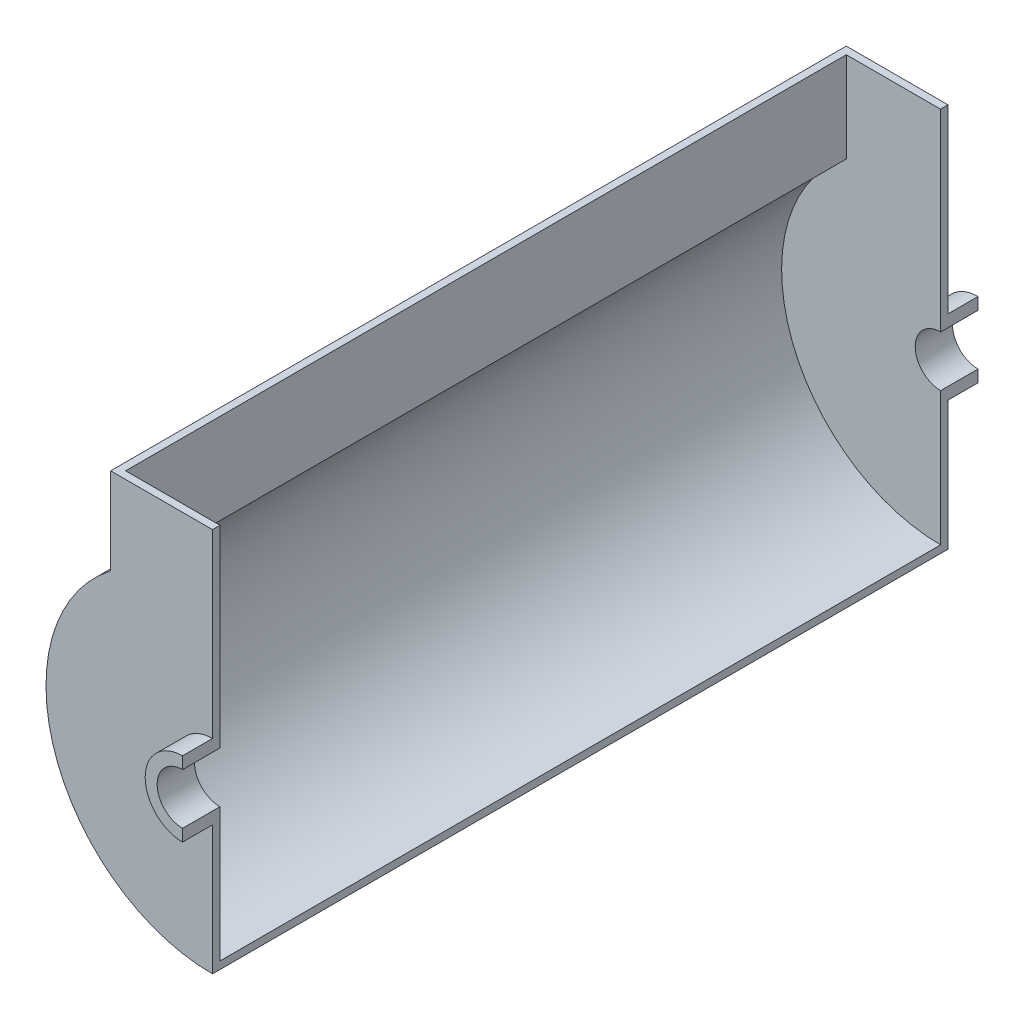
from build123d import *

# Parameters (mm, degrees)
BOSS_EXTRUDE1_DEPTH      = 20
BOSS_EXTRUDE1_DEPTH_BACK = 5
BOSS_EXTRUDE2_START      = -5
BOSS_EXTRUDE2_DEPTH      = 5
BOSS_EXTRUDE3_REACH      = 541.227


with BuildPart() as part:
    # Sketch1 → Boss-Extrude1 (new, two sides: drawn at the far end of the back side and taken through both)
    with BuildSketch(Plane.XY.offset(-BOSS_EXTRUDE1_DEPTH_BACK)):
        with BuildLine():
            Line((0, 25), (0, 17))
            ThreePointArc((0, 17), (-17, 0), (0, -17))
            Line((0, -17), (0, -25))
            ThreePointArc((0, -25), (-25, 0), (0, 25))
        make_face()
    extrude(amount=BOSS_EXTRUDE1_DEPTH + BOSS_EXTRUDE1_DEPTH_BACK)

    # Sketch2 → Boss-Extrude2 (add)
    with BuildSketch(Plane.XY.offset(BOSS_EXTRUDE2_START)):
        with BuildLine():
            Line((0, 25), (0, 146.014758251))
            Line((0, 146.014758251), (-68.093579632, 146.014758251))
            Line((-68.093579632, 146.014758251), (-68.093579632, 88.087940795))
            ThreePointArc((-68.093579632, 88.087940795), (-105.365516189, -35.976782774), (0, -111.338317306))
            Line((0, -111.338317306), (0, -25))
            ThreePointArc((0, -25), (-25, 0), (0, 25))
        make_face()
    extrude(amount=BOSS_EXTRUDE2_DEPTH)


with BuildPart() as body_2:
    # Mirror2: mirrored copy
    add(part.part.mirror(Plane.XY.offset(-246)))

    # Sketch3 → Boss-Extrude3 (add, up to next)
    with BuildSketch(Plane(origin=(0, 0, -5), x_dir=(-1, 0, 0), z_dir=(0, 0, -1)), mode=Mode.PRIVATE) as boss_extrude3_sk1:
        with BuildLine():
            Line((68.093579632, 146.014758251), (68.093579632, 88.087940795))
            ThreePointArc((68.093579632, 88.087940795), (105.365516189, -35.976782774), (0, -111.338317306))
            Line((0, -111.338317306), (0, -106.338317306))
            ThreePointArc((0, -106.338317306), (101.020289155, -33.207512802), (63.093579632, 85.598118769))
            Line((63.093579632, 85.598118769), (63.093579632, 146.014758251))
            Line((63.093579632, 146.014758251), (68.093579632, 146.014758251))
        make_face()
    boss_extrude3_tool1 = extrude(boss_extrude3_sk1.sketch, amount=BOSS_EXTRUDE3_REACH, mode=Mode.PRIVATE) - body_2.part

    add(part.part)  # Boss-Extrude3 merges part
    add(boss_extrude3_tool1.solids().sort_by_distance((-65.897627, 115.806439, -5))[0])


solid = body_2.part
